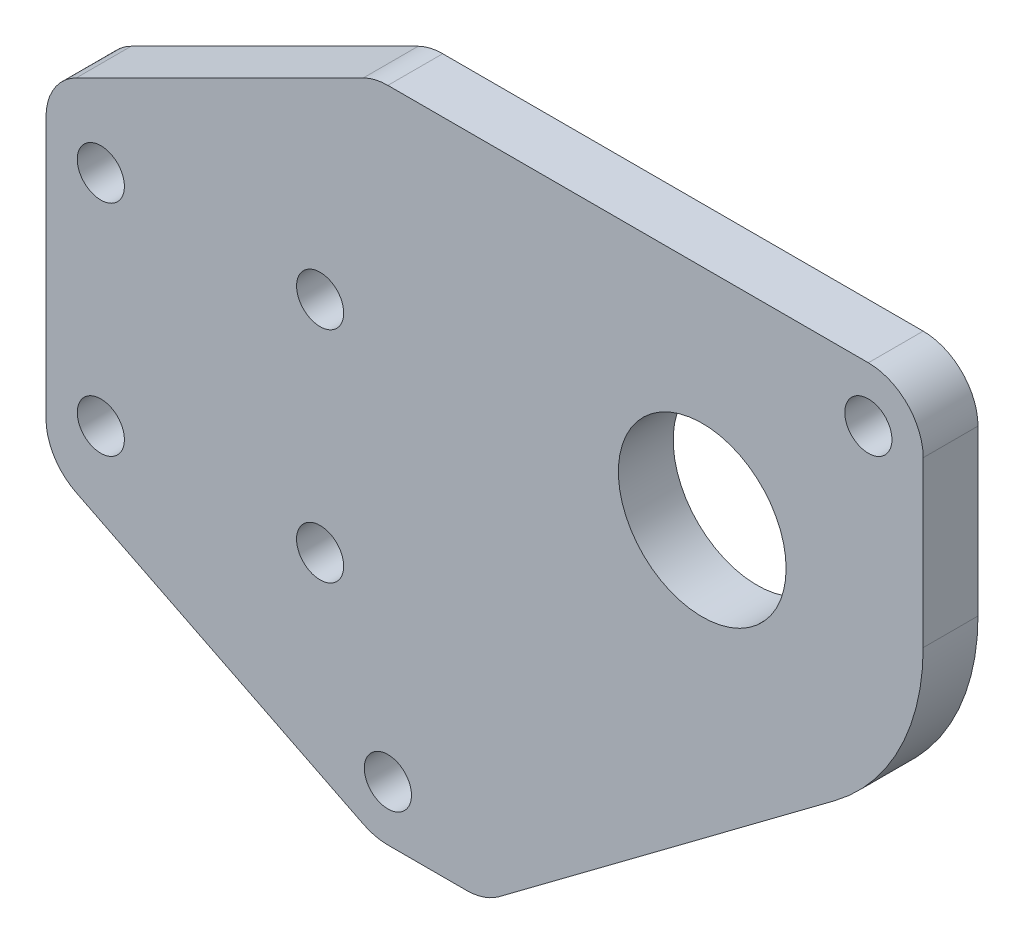
from build123d import *

# Parameters (mm, degrees)
SKETCH_1_W          = 80
SKETCH_1_H          = 60
SKETCH_1_R          = 7.65
EXTRUDE_1_DEPTH     = 5
SKETCH_2_R          = 2.15
CUT_EXTRUDE_1_DEPTH = 68.134361545
SKETCH_3_R          = 2.15
CUT_EXTRUDE_2_DEPTH = 68.134361545
CUT_EXTRUDE_3_DEPTH = 68.134361545
SKETCH_6_R          = 2.15
CUT_EXTRUDE_5_DEPTH = 68.134361545
FILLET_1_R          = 5


with BuildPart() as part:
    # ｽｹｯﾁ1 → ﾎﾞｽ - 押し出し1 (new body)
    with BuildSketch(Plane.XY):
        with Locations((-19.85, 0)):
            Rectangle(SKETCH_1_W, SKETCH_1_H)
        with Locations((0, 10)):
            Circle(SKETCH_1_R, mode=Mode.SUBTRACT)
    extrude(amount=EXTRUDE_1_DEPTH)

    # ｽｹｯﾁ2 → ｶｯﾄ - 押し出し1 (cut, through all)
    with BuildSketch(Plane.XY.offset(5)):
        with Locations((-54.85, 10)):
            Circle(SKETCH_2_R)
        with Locations(Location((-54.85, -10, 0), (0, 0, 180))):
            Circle(SKETCH_2_R)
        with Locations((-34.85, 10)):
            Circle(SKETCH_2_R)
        with Locations(Location((-34.85, -10, 0), (0, 0, 180))):
            Circle(SKETCH_2_R)
    extrude(amount=-CUT_EXTRUDE_1_DEPTH, mode=Mode.SUBTRACT)

    # ｽｹｯﾁ3 → ｶｯﾄ - 押し出し2 (cut, through all)
    with BuildSketch(Plane.XY.offset(5)):
        with Locations((15.15, 25)):
            Circle(SKETCH_3_R)
        with BuildLine():
            ThreePointArc((15.15, 30), (18.685533906, 28.535533906), (20.15, 25))
            Line((20.15, 25), (20.15, 30))
            Line((20.15, 30), (15.15, 30))
        make_face()
    extrude(amount=-CUT_EXTRUDE_2_DEPTH, mode=Mode.SUBTRACT)

    # ｽｹｯﾁ4 → ｶｯﾄ - 押し出し3 (cut, through all)
    with BuildSketch(Plane.XY.offset(5)):
        Polygon((-59.85, 30), (-59.85, 15), (-29.85, 30), align=None)
        Polygon((-29.85, -30), (-59.85, -15), (-59.85, -30), align=None)
        with BuildLine():
            Line((20.15, 0), (17.493498792, 0))
            ThreePointArc((17.493498792, 0), (15.094907291, -3.347893986), (12.06572435, -6.138178209))
            Line((12.06572435, -6.138178209), (-19.85, -30))
            Line((-19.85, -30), (20.15, -30))
            Line((20.15, -30), (20.15, 0))
        make_face()
        with BuildLine():
            ThreePointArc((20.15, 10), (19.474553919, 4.8265824), (17.493498792, 0))
            Line((17.493498792, 0), (20.15, 0))
            Line((20.15, 0), (20.15, 10))
        make_face()
    extrude(amount=-CUT_EXTRUDE_3_DEPTH, mode=Mode.SUBTRACT)

    # ｽｹｯﾁ6 → ｶｯﾄ - 押し出し5 (cut, through all)
    with BuildSketch(Plane.XY.offset(5)):
        with Locations((-28.669660113, -25)):
            Circle(SKETCH_6_R)
    extrude(amount=-CUT_EXTRUDE_5_DEPTH, mode=Mode.SUBTRACT)

    # ﾌｨﾚｯﾄ1
    fillet_1_edges = [part.edges().sort_by_distance(p)[0] for p in [
        (-59.85, 15, 2.5),
        (-29.85, 30, 2.5),
        (-59.85, -15, 2.5),
        (-29.85, -30, 2.5),
        (-19.85, -30, 2.5),
    ]]
    fillet(fillet_1_edges, radius=FILLET_1_R)


solid = part.part
